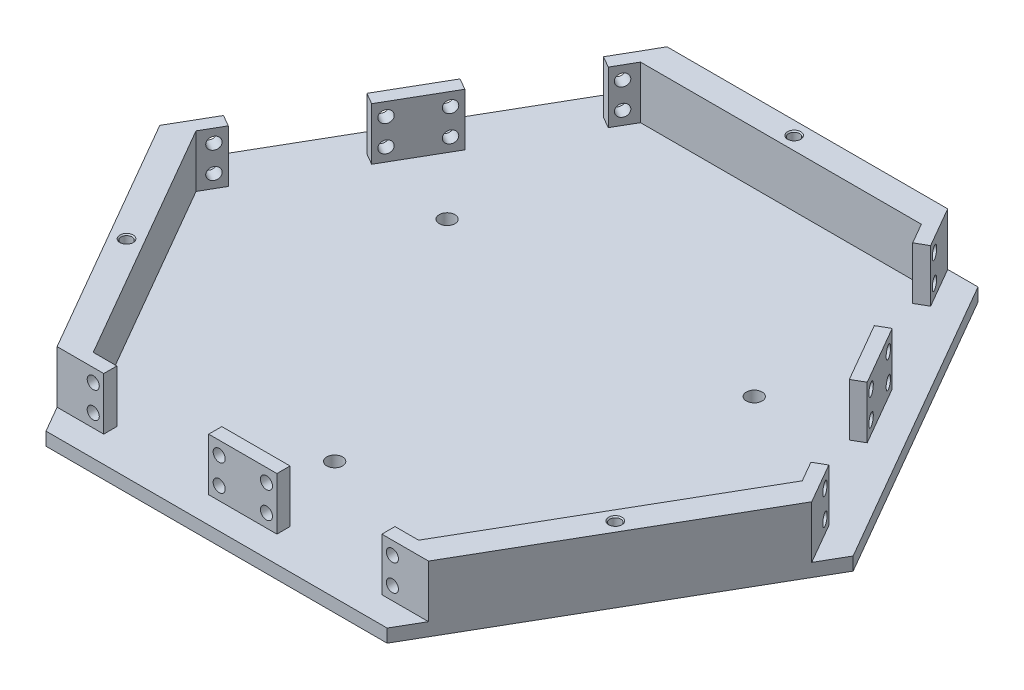
from build123d import *

# Parameters (mm, degrees)
EXTRUDE_5_DEPTH              = 5
SKETCH_7_W                   = 9
SKETCH_7_H                   = 5
SKETCH_7_W_2                 = 8
EXTRUDE_6_DEPTH              = 20
EXTRUDE_7_DEPTH              = 20
SKETCH_13_R                  = 2.3
CUT_EXTRUDE_2_DEPTH          = 20
SKETCH_9_R                   = 2.3
CUT_EXTRUDE_3_DEPTH          = 20
SKETCH_11_R                  = 2.3
CUT_EXTRUDE_4_DEPTH          = 20
SKETCH_16_R                  = 3
CUT_EXTRUDE_5_DEPTH          = 5
HOLE_WIZARD_M5_1_D           = 4.2
HOLE_WIZARD_M5_1_CSINK_D     = 5.05
HOLE_WIZARD_M5_1_CSINK_ANGLE = 90


with BuildPart() as part:
    # 草图6 → 凸台-拉伸5 (new body)
    with BuildSketch(Plane(origin=(0, 0, 0), x_dir=(1, 0, 0), z_dir=(0, 1, 0))):
        Polygon((130, 0), (65, 112.583302492), (-65, 112.583302492), (-130, 0), (-65, -112.583302492), (65, -112.583302492), align=None)
    extrude(amount=EXTRUDE_5_DEPTH)

    # 草图7 → 凸台-拉伸6 (add)
    with BuildSketch(Plane(origin=(0, 5, 0), x_dir=(1, 0, 0), z_dir=(0, 1, 0))):
        with Locations((57.5, -100.083302492)):
            Rectangle(SKETCH_7_W, SKETCH_7_H)
        with Locations((8.5, -100.083302492)):
            Rectangle(SKETCH_7_W, SKETCH_7_H)
        with Locations((0, -100.083302492)):
            Rectangle(SKETCH_7_W_2, SKETCH_7_H)
        with Locations((-8.5, -100.083302492)):
            Rectangle(SKETCH_7_W, SKETCH_7_H)
        with Locations((-57.5, -100.083302492)):
            Rectangle(SKETCH_7_W, SKETCH_7_H)
        Polygon((115.339745962, 5.392304845), (119.839745962, -2.401923789), (115.509618943, -4.901923789), (111.009618943, 2.892304845), align=None)
        Polygon((95.339745962, 40.033320997), (91.009618943, 37.533320997), (86.009618943, 46.193575035), (90.339745962, 48.693575035), align=None)
        Polygon((86.839745962, 54.755752861), (82.509618943, 52.255752861), (86.009618943, 46.193575035), (90.339745962, 48.693575035), align=None)
        Polygon((82.339745962, 62.549981495), (86.839745962, 54.755752861), (82.509618943, 52.255752861), (78.009618943, 60.049981495), align=None)
        Polygon((62.339745962, 97.190997647), (58.009618943, 94.690997647), (53.509618943, 102.485226281), (57.839745962, 104.985226281), align=None)
        Polygon((-57.839745962, 104.985226281), (-53.509618943, 102.485226281), (-58.009618943, 94.690997647), (-62.339745962, 97.190997647), align=None)
        Polygon((-82.339745962, 62.549981495), (-86.839745962, 54.755752861), (-82.509618943, 52.255752861), (-78.009618943, 60.049981495), align=None)
        Polygon((-86.839745962, 54.755752861), (-82.509618943, 52.255752861), (-86.009618943, 46.193575035), (-90.339745962, 48.693575035), align=None)
        Polygon((-90.339745962, 48.693575035), (-86.009618943, 46.193575035), (-91.009618943, 37.533320997), (-95.339745962, 40.033320997), align=None)
        Polygon((-115.339745962, 5.392304845), (-119.839745962, -2.401923789), (-115.509618943, -4.901923789), (-111.009618943, 2.892304845), align=None)
    extrude(amount=EXTRUDE_6_DEPTH)

    # 草图10 → 凸台-拉伸7 (add)
    with BuildSketch(Plane(origin=(0, 5, 0), x_dir=(1, 0, 0), z_dir=(0, 1, 0))):
        Polygon((-115.509618943, -4.901923789), (-62, -97.583302492), (-62, -102.583302492), (-70.773502692, -102.583302492), (-124.226497308, -10), (-119.839745962, -2.401923789), align=None)
        Polygon((62, -97.583302492), (115.509618943, -4.901923789), (119.839745962, -2.401923789), (124.226497308, -10), (70.773502692, -102.583302492), (62, -102.583302492), align=None)
        Polygon((57.839745962, 104.985226281), (53.509618943, 102.485226281), (-53.509618943, 102.485226281), (-57.839745962, 104.985226281), (-53.509618943, 112.583302492), (53.452994616, 112.583302492), align=None)
    extrude(amount=EXTRUDE_7_DEPTH)

    # 草图13 → 切除-拉伸2 (cut)
    with BuildSketch(Plane(origin=(-88.839745962, 0, -51.291651246), x_dir=(-0.5000000000000006, 0, 0.8660254037844384), z_dir=(-0.8660254037844384, 0, -0.5000000000000006))):
        with Locations((-57, 20)):
            Circle(SKETCH_13_R)
        with Locations((-57, 10)):
            Circle(SKETCH_13_R)
        with Locations((-9, 20)):
            Circle(SKETCH_13_R)
        with Locations((-9, 10)):
            Circle(SKETCH_13_R)
        with Locations(Location((9, 10, 0), (0, 0, 180))):
            Circle(SKETCH_13_R)
        with Locations(Location((9, 20, 0), (0, 0, 180))):
            Circle(SKETCH_13_R)
        with Locations(Location((57, 10, 0), (0, 0, 180))):
            Circle(SKETCH_13_R)
        with Locations(Location((57, 20, 0), (0, 0, 180))):
            Circle(SKETCH_13_R)
    extrude(amount=-CUT_EXTRUDE_2_DEPTH, mode=Mode.SUBTRACT)

    # 草图9 → 切除-拉伸3 (cut)
    with BuildSketch(Plane.XY.offset(102.583302492)):
        with Locations((-57, 20)):
            Circle(SKETCH_9_R)
        with Locations((-57, 10)):
            Circle(SKETCH_9_R)
        with Locations((-9, 20)):
            Circle(SKETCH_9_R)
        with Locations((-9, 10)):
            Circle(SKETCH_9_R)
        with Locations((9, 20)):
            Circle(SKETCH_9_R)
        with Locations((9, 10)):
            Circle(SKETCH_9_R)
        with Locations((57, 20)):
            Circle(SKETCH_9_R)
        with Locations((57, 10)):
            Circle(SKETCH_9_R)
    extrude(amount=-CUT_EXTRUDE_3_DEPTH, mode=Mode.SUBTRACT)

    # 草图11 → 切除-拉伸4 (cut)
    with BuildSketch(Plane(origin=(88.839745962, 0, -51.291651246), x_dir=(-0.5000000000000029, 0, -0.866025403784437), z_dir=(0.8660254037844369, 0, -0.5000000000000028))):
        with Locations((-57, 20)):
            Circle(SKETCH_11_R)
        with Locations((-57, 9.847641324)):
            Circle(SKETCH_11_R)
        with Locations((-9, 20)):
            Circle(SKETCH_11_R)
        with Locations((-9, 9.847641324)):
            Circle(SKETCH_11_R)
        with Locations(Location((9, 9.847641324, 0), (0, 0, 180))):
            Circle(SKETCH_11_R)
        with Locations(Location((9, 20, 0), (0, 0, 180))):
            Circle(SKETCH_11_R)
        with Locations(Location((57, 9.847641324, 0), (0, 0, 180))):
            Circle(SKETCH_11_R)
        with Locations(Location((57, 20, 0), (0, 0, 180))):
            Circle(SKETCH_11_R)
    extrude(amount=-CUT_EXTRUDE_4_DEPTH, mode=Mode.SUBTRACT)

    # 草图16 → 切除-拉伸5 (cut)
    with BuildSketch(Plane(origin=(0, 5, 0), x_dir=(1, 0, 0), z_dir=(0, 1, 0))):
        with Locations(Location((0, -67.583302492, 0), (0, 0, 270))):
            Circle(SKETCH_16_R)
        with Locations(Location((58.52885683, 33.791651246, 0), (0, 0, 270))):
            Circle(SKETCH_16_R)
        with Locations(Location((-58.52885683, 33.791651246, 0), (0, 0, 270))):
            Circle(SKETCH_16_R)
    extrude(amount=-CUT_EXTRUDE_5_DEPTH, mode=Mode.SUBTRACT)

    # M5 螺纹孔1 (through all)
    with Locations(Plane(origin=(0, 25, 0), x_dir=(1, 0, 0), z_dir=(0, 1, 0))):
        with Locations((93.127404736, -53.767132193), (-93.127404736, -53.767132193), (-0.014156082, 107.534264386)):
            CounterSinkHole(HOLE_WIZARD_M5_1_D / 2, HOLE_WIZARD_M5_1_CSINK_D / 2, counter_sink_angle=HOLE_WIZARD_M5_1_CSINK_ANGLE)


solid = part.part
